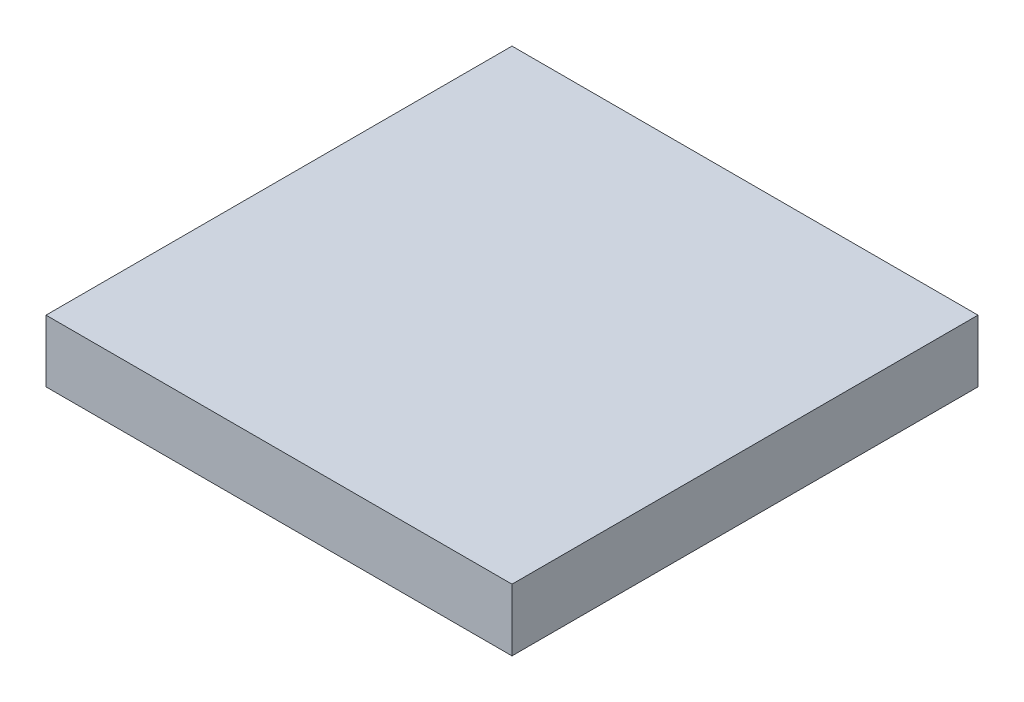
from build123d import *

# Parameters (mm, degrees)
SKETCH1_W           = 750
SKETCH1_H           = 750
BOSS_EXTRUDE1_DEPTH = 100
SKETCH3_W           = 600
SKETCH3_H           = 600
CUT_EXTRUDE2_DEPTH  = 50


with BuildPart() as part:
    # Sketch1 → Boss-Extrude1 (new body)
    with BuildSketch(Plane(origin=(0, 0, 0), x_dir=(1, 0, 0), z_dir=(0, 1, 0))):
        Rectangle(SKETCH1_W, SKETCH1_H)
    extrude(amount=BOSS_EXTRUDE1_DEPTH)

    # Sketch3 → Cut-Extrude2 (cut)
    with BuildSketch(Plane.XZ):
        Rectangle(SKETCH3_W, SKETCH3_H)
    extrude(amount=-CUT_EXTRUDE2_DEPTH, mode=Mode.SUBTRACT)


solid = part.part
